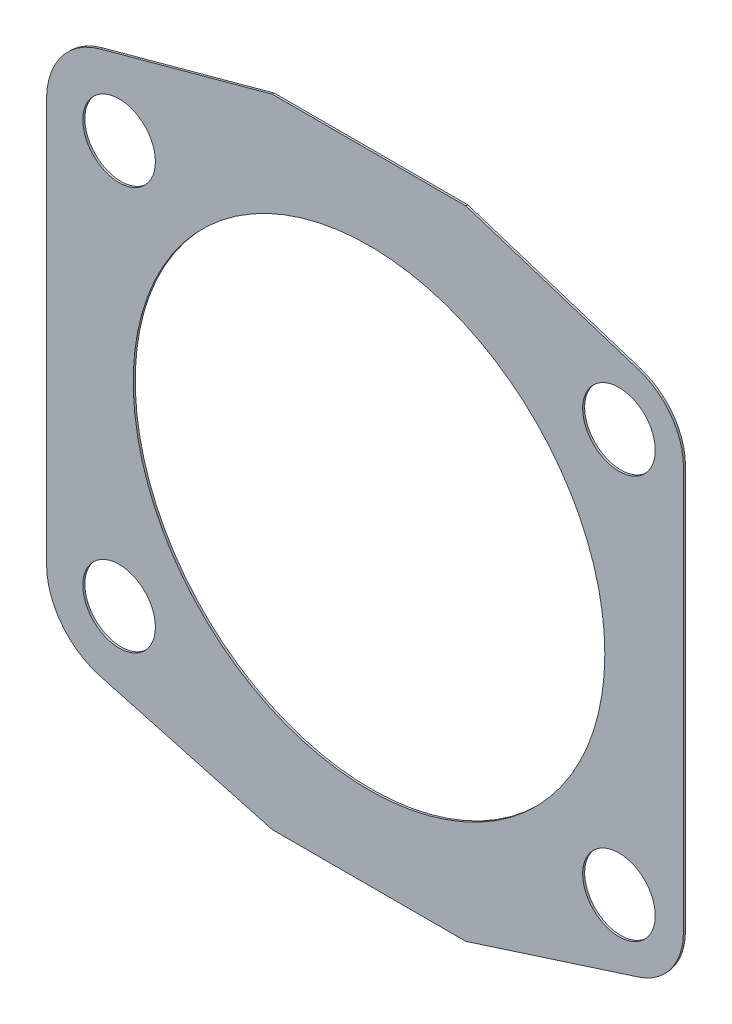
from build123d import *

# Parameters (mm, degrees)
SKETCH1_R      = 58.5
SKETCH1_R_2    = 9
EXTRUDE1_DEPTH = 0.5


with BuildPart() as part:
    # Sketch1 → Extrude1 (new body)
    with BuildSketch(Plane.XY):
        with BuildLine():
            Line((-66.728148699, -67.367918985), (-24, -79))
            Line((-24, -79), (24, -79))
            Line((24, -79), (66.889545754, -65.234577195))
            ThreePointArc((66.889545754, -65.234577195), (74.927349536, -59.427811727), (78, -50))
            Line((78, -50), (78, 50))
            ThreePointArc((78, 50), (74.927349536, 59.427811727), (66.889545754, 65.234577195))
            Line((66.889545754, 65.234577195), (24, 79))
            Line((24, 79), (-24, 79))
            Line((-24, 79), (-66.728148699, 67.367918985))
            ThreePointArc((-66.728148699, 67.367918985), (-76.302214454, 60.929165645), (-80, 50))
            Line((-80, 50), (-80, -50))
            ThreePointArc((-80, -50), (-76.302214454, -60.929165645), (-66.728148699, -67.367918985))
        make_face()
        Circle(SKETCH1_R, mode=Mode.SUBTRACT)
        with Locations((62, -50)):
            Circle(SKETCH1_R_2, mode=Mode.SUBTRACT)
        with Locations((-62, -50)):
            Circle(SKETCH1_R_2, mode=Mode.SUBTRACT)
        with Locations((62, 50)):
            Circle(SKETCH1_R_2, mode=Mode.SUBTRACT)
        with Locations((-62, 50)):
            Circle(SKETCH1_R_2, mode=Mode.SUBTRACT)
    extrude(amount=EXTRUDE1_DEPTH)


solid = part.part
